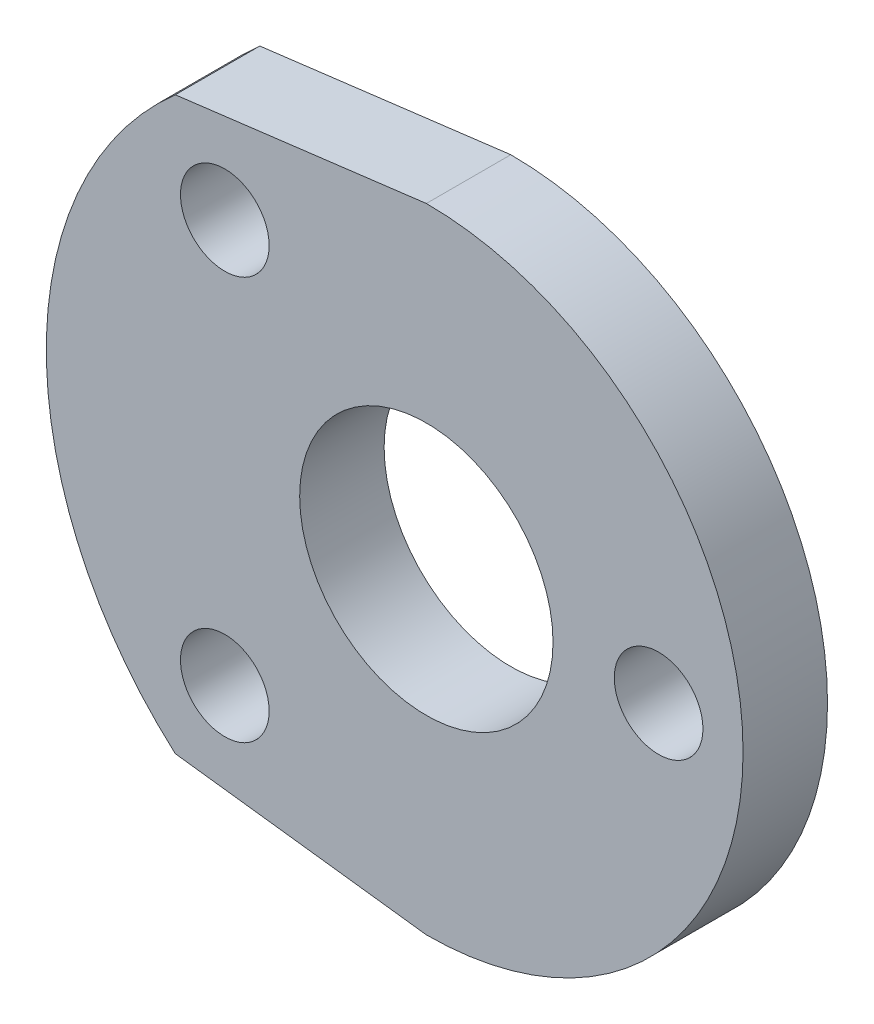
from build123d import *

# Parameters (mm, degrees)
ESQUISSE1_R        = 1.05
ESQUISSE1_R_2      = 3
BOSS_EXTRU_1_DEPTH = 2


with BuildPart() as part:
    # Esquisse1 → Boss.-Extru.1 (new body)
    with BuildSketch(Plane.XY):
        with BuildLine():
            ThreePointArc((-5.945158342, 6.756855207), (-9, 0), (-5.945158342, -6.756855207))
            Line((-5.945158342, -6.756855207), (0, -7.5))
            ThreePointArc((0, -7.5), (7.5, 0), (0, 7.5))
            Line((0, 7.5), (-5.945158342, 6.756855207))
        make_face()
        with Locations((-4.772970773, 4.772970773)):
            Circle(ESQUISSE1_R, mode=Mode.SUBTRACT)
        with Locations((-4.772970773, -4.772970773)):
            Circle(ESQUISSE1_R, mode=Mode.SUBTRACT)
        Circle(ESQUISSE1_R_2, mode=Mode.SUBTRACT)
        with Locations((5.5, 0)):
            Circle(ESQUISSE1_R, mode=Mode.SUBTRACT)
    extrude(amount=BOSS_EXTRU_1_DEPTH)


solid = part.part
